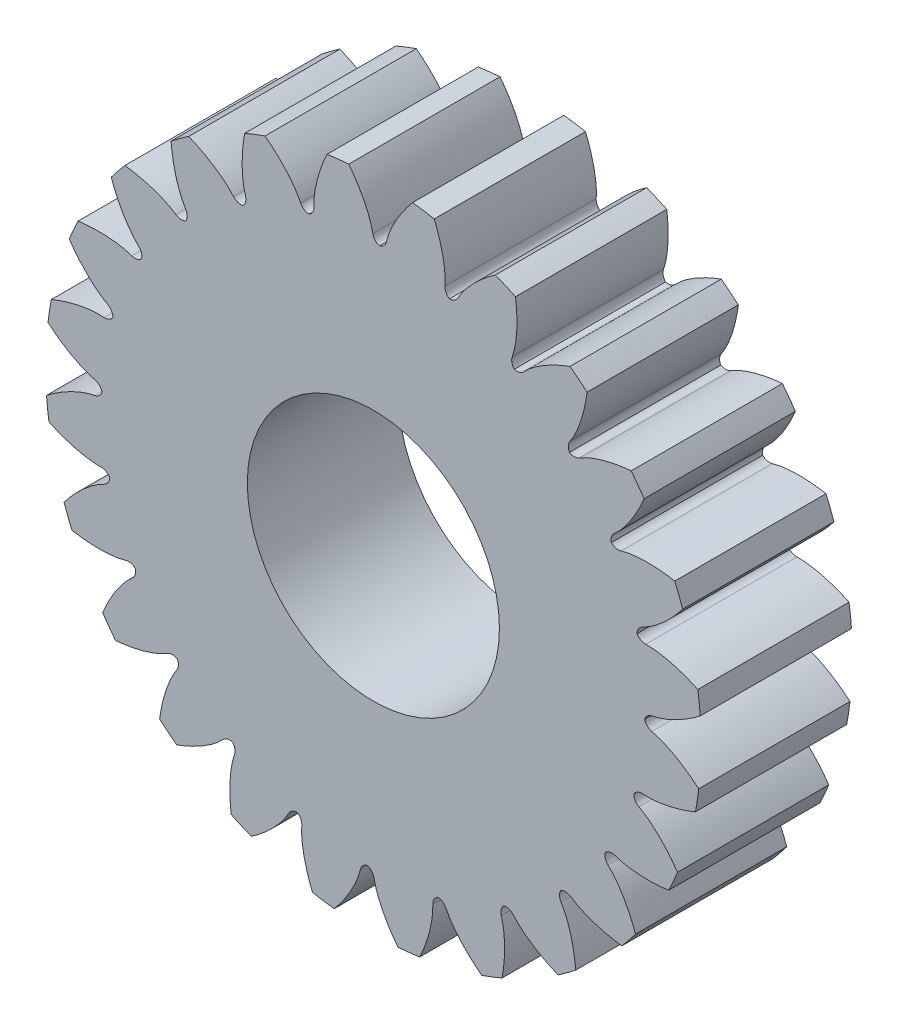
from build123d import *

# Parameters (mm, degrees)
BOSS_EXTRUDE1_DEPTH = 3
BOSS_EXTRUDE2_DEPTH = 3
CIRPATTERN1_COUNT   = 24
SKETCH6_R           = 2.5
CUT_EXTRUDE1_DEPTH  = 10.644930258


with BuildPart() as part:
    # Sketch4 → Boss-Extrude1 (new body)
    with BuildSketch(Plane.XY):
        with BuildLine():
            ThreePointArc((5.372315926, -0.169842845), (5.37432894, -0.084932026), (5.375, 0))
            ThreePointArc((5.375, 0), (5.333549966, 0.666235515), (5.209839158, 1.322195501))
            ThreePointArc((5.209839158, 1.322195501), (-5.343411472, -0.581875275), (5.372315926, -0.169842845))
        make_face()
    extrude(amount=BOSS_EXTRUDE1_DEPTH)

    # Sketch4<3> → Boss-Extrude2 (add)
    with BuildSketch(Plane.XY):
        with BuildLine():
            ThreePointArc((5.209839158, 1.322195501), (5.333549966, 0.666235515), (5.375, 0))
            ThreePointArc((5.375, 0), (5.37432894, -0.084932026), (5.372315926, -0.169842845))
            ThreePointArc((5.372315926, -0.169842845), (5.418124408, -0.052007365), (5.527733036, 0.010997128))
            add(Edge.make_bspline(
                [(5.527733036, 0.010997128), (5.547226898, 0.014595348), (5.578975035, 0.021331025), (5.622716733, 0.032231179), (5.678088811, 0.048480488), (5.726073258, 0.06416837), (5.773618864, 0.081218991), (5.82067241, 0.099462805), (5.87727149, 0.123038096), (5.944565332, 0.153353591), (6.022300708, 0.191735507), (6.109312893, 0.238721464), (6.196645019, 0.290245866), (6.281434021, 0.343919134), (6.364306251, 0.400569265), (6.423424042, 0.443186937), (6.462820606, 0.472981157), (6.481692544, 0.48750565)],
                knots=[0.04913035, 0.04913035, 0.04913035, 0.04913035, 0.04913035, 0.092110525, 0.119476176, 0.146842496, 0.174208854, 0.201574956, 0.228941013, 0.256307345, 0.307035032, 0.361767352, 0.416499661, 0.471231936, 0.525964282, 0.580696615, 0.631873077, 0.631873077, 0.631873077, 0.631873077, 0.631873077], degree=4))
            ThreePointArc((6.481692544, 0.48750565), (6.46179992, 0.703663123), (6.434700704, 0.919035828))
            add(Edge.make_bspline(
                [(5.400537369, 1.179046046), (5.420348799, 1.179728009), (5.452802585, 1.179983654), (5.497865177, 1.178753917), (5.555436898, 1.174803718), (5.605673303, 1.169811678), (5.655774467, 1.163394384), (5.705651926, 1.155705953), (5.765998729, 1.144865582), (5.838240379, 1.129744922), (5.922415039, 1.108994335), (6.017500999, 1.081838108), (6.113876253, 1.050318675), (6.208230511, 1.016153363), (6.301353662, 0.978668396), (6.368258808, 0.949774098), (6.413144857, 0.929157904), (6.434700704, 0.919035828)],
                knots=[0.04913035, 0.04913035, 0.04913035, 0.04913035, 0.04913035, 0.092110525, 0.119476176, 0.146842496, 0.174208854, 0.201574956, 0.228941013, 0.256307345, 0.307035032, 0.361767352, 0.416499661, 0.471231936, 0.525964282, 0.580696615, 0.631873077, 0.631873077, 0.631873077, 0.631873077, 0.631873077], degree=4))
            ThreePointArc((5.400537369, 1.179046046), (5.279936778, 1.216981713), (5.209839159, 1.322195501))
        make_face()
    boss_extrude2 = extrude(amount=BOSS_EXTRUDE2_DEPTH)

    # CirPattern1: Boss-Extrude2 ×24 about axis
    cirpattern1_axis = Axis((0, 0, 3), (0, 0, -1))
    for i in range(1, CIRPATTERN1_COUNT):
        add(boss_extrude2.rotate(cirpattern1_axis, i * 360 / CIRPATTERN1_COUNT))

    # Sketch6 → Cut-Extrude1 (cut, through all)
    with BuildSketch(Plane.XY):
        Circle(SKETCH6_R)
    extrude(amount=CUT_EXTRUDE1_DEPTH, mode=Mode.SUBTRACT)


solid = part.part
